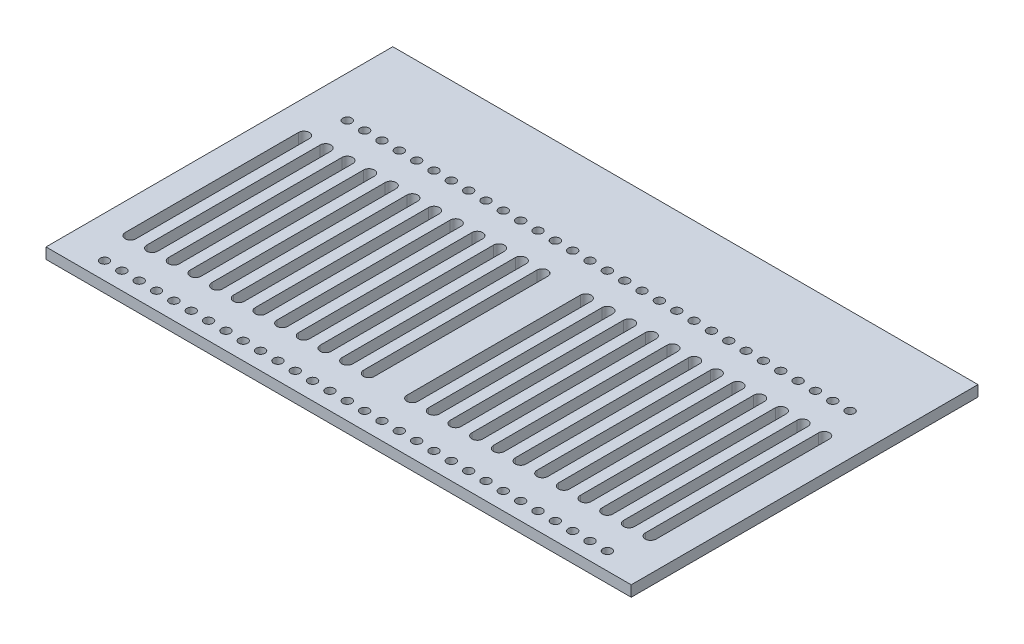
from build123d import *

# Parameters (mm, degrees)
SKETCH1_W           = 270
SKETCH1_H           = 160
BOSS_EXTRUDE1_DEPTH = 5
SKETCH2_R           = 2.025
CUT_EXTRUDE1_DEPTH  = 314.886922314
CUT_EXTRUDE2_DEPTH  = 314.886922314


with BuildPart() as part:
    # Sketch1 → Boss-Extrude1 (new body)
    with BuildSketch(Plane(origin=(0, 0, 0), x_dir=(1, 0, 0), z_dir=(0, 1, 0))):
        with Locations((135, -80)):
            Rectangle(SKETCH1_W, SKETCH1_H)
    extrude(amount=BOSS_EXTRUDE1_DEPTH)

    # Sketch2 → Cut-Extrude1 (cut, through all)
    with BuildSketch(Plane(origin=(0, 5, 0), x_dir=(1, 0, 0), z_dir=(0, 1, 0))):
        with Locations(Location((139, -152, 0), (0, 0, 270))):
            Circle(SKETCH2_R)
        with Locations(Location((147, -152, 0), (0, 0, 270))):
            Circle(SKETCH2_R)
        with Locations(Location((155, -152, 0), (0, 0, 270))):
            Circle(SKETCH2_R)
        with Locations(Location((163, -152, 0), (0, 0, 270))):
            Circle(SKETCH2_R)
        with Locations(Location((171, -152, 0), (0, 0, 270))):
            Circle(SKETCH2_R)
        with Locations(Location((179, -152, 0), (0, 0, 270))):
            Circle(SKETCH2_R)
        with Locations(Location((187, -152, 0), (0, 0, 270))):
            Circle(SKETCH2_R)
        with Locations(Location((195, -152, 0), (0, 0, 270))):
            Circle(SKETCH2_R)
        with Locations(Location((203, -152, 0), (0, 0, 270))):
            Circle(SKETCH2_R)
        with Locations(Location((211, -152, 0), (0, 0, 270))):
            Circle(SKETCH2_R)
        with Locations(Location((219, -152, 0), (0, 0, 270))):
            Circle(SKETCH2_R)
        with Locations(Location((227, -152, 0), (0, 0, 270))):
            Circle(SKETCH2_R)
        with Locations(Location((235, -152, 0), (0, 0, 270))):
            Circle(SKETCH2_R)
        with Locations(Location((243, -152, 0), (0, 0, 270))):
            Circle(SKETCH2_R)
        with Locations(Location((251, -152, 0), (0, 0, 270))):
            Circle(SKETCH2_R)
        with Locations(Location((19, -152, 0), (0, 0, 90))):
            Circle(SKETCH2_R)
        with Locations(Location((27, -152, 0), (0, 0, 90))):
            Circle(SKETCH2_R)
        with Locations(Location((35, -152, 0), (0, 0, 90))):
            Circle(SKETCH2_R)
        with Locations(Location((43, -152, 0), (0, 0, 90))):
            Circle(SKETCH2_R)
        with Locations(Location((51, -152, 0), (0, 0, 90))):
            Circle(SKETCH2_R)
        with Locations(Location((59, -152, 0), (0, 0, 90))):
            Circle(SKETCH2_R)
        with Locations(Location((67, -152, 0), (0, 0, 90))):
            Circle(SKETCH2_R)
        with Locations(Location((75, -152, 0), (0, 0, 90))):
            Circle(SKETCH2_R)
        with Locations(Location((83, -152, 0), (0, 0, 90))):
            Circle(SKETCH2_R)
        with Locations(Location((91, -152, 0), (0, 0, 90))):
            Circle(SKETCH2_R)
        with Locations(Location((99, -152, 0), (0, 0, 90))):
            Circle(SKETCH2_R)
        with Locations(Location((107, -152, 0), (0, 0, 90))):
            Circle(SKETCH2_R)
        with Locations(Location((115, -152, 0), (0, 0, 90))):
            Circle(SKETCH2_R)
        with Locations(Location((123, -152, 0), (0, 0, 90))):
            Circle(SKETCH2_R)
        with Locations(Location((131, -152, 0), (0, 0, 90))):
            Circle(SKETCH2_R)
        with Locations(Location((131, -40, 0), (0, 0, 270))):
            Circle(SKETCH2_R)
        with Locations(Location((123, -40, 0), (0, 0, 270))):
            Circle(SKETCH2_R)
        with Locations(Location((115, -40, 0), (0, 0, 270))):
            Circle(SKETCH2_R)
        with Locations(Location((107, -40, 0), (0, 0, 270))):
            Circle(SKETCH2_R)
        with Locations(Location((99, -40, 0), (0, 0, 270))):
            Circle(SKETCH2_R)
        with Locations(Location((91, -40, 0), (0, 0, 270))):
            Circle(SKETCH2_R)
        with Locations(Location((83, -40, 0), (0, 0, 270))):
            Circle(SKETCH2_R)
        with Locations(Location((75, -40, 0), (0, 0, 270))):
            Circle(SKETCH2_R)
        with Locations(Location((67, -40, 0), (0, 0, 270))):
            Circle(SKETCH2_R)
        with Locations(Location((59, -40, 0), (0, 0, 270))):
            Circle(SKETCH2_R)
        with Locations(Location((51, -40, 0), (0, 0, 270))):
            Circle(SKETCH2_R)
        with Locations(Location((43, -40, 0), (0, 0, 270))):
            Circle(SKETCH2_R)
        with Locations(Location((35, -40, 0), (0, 0, 270))):
            Circle(SKETCH2_R)
        with Locations(Location((27, -40, 0), (0, 0, 270))):
            Circle(SKETCH2_R)
        with Locations(Location((19, -40, 0), (0, 0, 270))):
            Circle(SKETCH2_R)
        with Locations(Location((251, -40, 0), (0, 0, 90))):
            Circle(SKETCH2_R)
        with Locations(Location((243, -40, 0), (0, 0, 90))):
            Circle(SKETCH2_R)
        with Locations(Location((235, -40, 0), (0, 0, 90))):
            Circle(SKETCH2_R)
        with Locations(Location((227, -40, 0), (0, 0, 90))):
            Circle(SKETCH2_R)
        with Locations(Location((219, -40, 0), (0, 0, 90))):
            Circle(SKETCH2_R)
        with Locations(Location((211, -40, 0), (0, 0, 90))):
            Circle(SKETCH2_R)
        with Locations(Location((203, -40, 0), (0, 0, 90))):
            Circle(SKETCH2_R)
        with Locations(Location((195, -40, 0), (0, 0, 90))):
            Circle(SKETCH2_R)
        with Locations(Location((187, -40, 0), (0, 0, 90))):
            Circle(SKETCH2_R)
        with Locations(Location((179, -40, 0), (0, 0, 90))):
            Circle(SKETCH2_R)
        with Locations(Location((171, -40, 0), (0, 0, 90))):
            Circle(SKETCH2_R)
        with Locations(Location((163, -40, 0), (0, 0, 90))):
            Circle(SKETCH2_R)
        with Locations(Location((155, -40, 0), (0, 0, 90))):
            Circle(SKETCH2_R)
        with Locations(Location((147, -40, 0), (0, 0, 90))):
            Circle(SKETCH2_R)
        with Locations(Location((139, -40, 0), (0, 0, 90))):
            Circle(SKETCH2_R)
    extrude(amount=-CUT_EXTRUDE1_DEPTH, mode=Mode.SUBTRACT)

    # Sketch3 → Cut-Extrude2 (cut, through all)
    with BuildSketch(Plane(origin=(0, 5, 0), x_dir=(1, 0, 0), z_dir=(0, 1, 0))):
        with BuildLine():
            Line((147.5, -56), (147.5, -136))
            ThreePointArc((147.5, -136), (145, -138.5), (142.5, -136))
            Line((142.5, -136), (142.5, -56))
            ThreePointArc((142.5, -56), (145, -53.5), (147.5, -56))
        make_face()
        with BuildLine():
            Line((157.5, -56), (157.5, -136))
            ThreePointArc((157.5, -136), (155, -138.5), (152.5, -136))
            Line((152.5, -136), (152.5, -56))
            ThreePointArc((152.5, -56), (155, -53.5), (157.5, -56))
        make_face()
        with BuildLine():
            Line((167.5, -56), (167.5, -136))
            ThreePointArc((167.5, -136), (165, -138.5), (162.5, -136))
            Line((162.5, -136), (162.5, -56))
            ThreePointArc((162.5, -56), (165, -53.5), (167.5, -56))
        make_face()
        with BuildLine():
            Line((177.5, -56), (177.5, -136))
            ThreePointArc((177.5, -136), (175, -138.5), (172.5, -136))
            Line((172.5, -136), (172.5, -56))
            ThreePointArc((172.5, -56), (175, -53.5), (177.5, -56))
        make_face()
        with BuildLine():
            Line((187.5, -56), (187.5, -136))
            ThreePointArc((187.5, -136), (185, -138.5), (182.5, -136))
            Line((182.5, -136), (182.5, -56))
            ThreePointArc((182.5, -56), (185, -53.5), (187.5, -56))
        make_face()
        with BuildLine():
            Line((197.5, -56), (197.5, -136))
            ThreePointArc((197.5, -136), (195, -138.5), (192.5, -136))
            Line((192.5, -136), (192.5, -56))
            ThreePointArc((192.5, -56), (195, -53.5), (197.5, -56))
        make_face()
        with BuildLine():
            Line((207.5, -56), (207.5, -136))
            ThreePointArc((207.5, -136), (205, -138.5), (202.5, -136))
            Line((202.5, -136), (202.5, -56))
            ThreePointArc((202.5, -56), (205, -53.5), (207.5, -56))
        make_face()
        with BuildLine():
            Line((217.5, -56), (217.5, -136))
            ThreePointArc((217.5, -136), (215, -138.5), (212.5, -136))
            Line((212.5, -136), (212.5, -56))
            ThreePointArc((212.5, -56), (215, -53.5), (217.5, -56))
        make_face()
        with BuildLine():
            Line((227.5, -56), (227.5, -136))
            ThreePointArc((227.5, -136), (225, -138.5), (222.5, -136))
            Line((222.5, -136), (222.5, -56))
            ThreePointArc((222.5, -56), (225, -53.5), (227.5, -56))
        make_face()
        with BuildLine():
            Line((237.5, -56), (237.5, -136))
            ThreePointArc((237.5, -136), (235, -138.5), (232.5, -136))
            Line((232.5, -136), (232.5, -56))
            ThreePointArc((232.5, -56), (235, -53.5), (237.5, -56))
        make_face()
        with BuildLine():
            Line((247.5, -56), (247.5, -136))
            ThreePointArc((247.5, -136), (245, -138.5), (242.5, -136))
            Line((242.5, -136), (242.5, -56))
            ThreePointArc((242.5, -56), (245, -53.5), (247.5, -56))
        make_face()
        with BuildLine():
            Line((257.5, -56), (257.5, -136))
            ThreePointArc((257.5, -136), (255, -138.5), (252.5, -136))
            Line((252.5, -136), (252.5, -56))
            ThreePointArc((252.5, -56), (255, -53.5), (257.5, -56))
        make_face()
        with BuildLine():
            Line((122.5, -56), (122.5, -136))
            ThreePointArc((122.5, -136), (125, -138.5), (127.5, -136))
            Line((127.5, -136), (127.5, -56))
            ThreePointArc((127.5, -56), (125, -53.5), (122.5, -56))
        make_face()
        with BuildLine():
            Line((112.5, -56), (112.5, -136))
            ThreePointArc((112.5, -136), (115, -138.5), (117.5, -136))
            Line((117.5, -136), (117.5, -56))
            ThreePointArc((117.5, -56), (115, -53.5), (112.5, -56))
        make_face()
        with BuildLine():
            Line((102.5, -56), (102.5, -136))
            ThreePointArc((102.5, -136), (105, -138.5), (107.5, -136))
            Line((107.5, -136), (107.5, -56))
            ThreePointArc((107.5, -56), (105, -53.5), (102.5, -56))
        make_face()
        with BuildLine():
            Line((92.5, -56), (92.5, -136))
            ThreePointArc((92.5, -136), (95, -138.5), (97.5, -136))
            Line((97.5, -136), (97.5, -56))
            ThreePointArc((97.5, -56), (95, -53.5), (92.5, -56))
        make_face()
        with BuildLine():
            Line((82.5, -56), (82.5, -136))
            ThreePointArc((82.5, -136), (85, -138.5), (87.5, -136))
            Line((87.5, -136), (87.5, -56))
            ThreePointArc((87.5, -56), (85, -53.5), (82.5, -56))
        make_face()
        with BuildLine():
            Line((72.5, -56), (72.5, -136))
            ThreePointArc((72.5, -136), (75, -138.5), (77.5, -136))
            Line((77.5, -136), (77.5, -56))
            ThreePointArc((77.5, -56), (75, -53.5), (72.5, -56))
        make_face()
        with BuildLine():
            Line((62.5, -56), (62.5, -136))
            ThreePointArc((62.5, -136), (65, -138.5), (67.5, -136))
            Line((67.5, -136), (67.5, -56))
            ThreePointArc((67.5, -56), (65, -53.5), (62.5, -56))
        make_face()
        with BuildLine():
            Line((52.5, -56), (52.5, -136))
            ThreePointArc((52.5, -136), (55, -138.5), (57.5, -136))
            Line((57.5, -136), (57.5, -56))
            ThreePointArc((57.5, -56), (55, -53.5), (52.5, -56))
        make_face()
        with BuildLine():
            Line((42.5, -56), (42.5, -136))
            ThreePointArc((42.5, -136), (45, -138.5), (47.5, -136))
            Line((47.5, -136), (47.5, -56))
            ThreePointArc((47.5, -56), (45, -53.5), (42.5, -56))
        make_face()
        with BuildLine():
            Line((32.5, -56), (32.5, -136))
            ThreePointArc((32.5, -136), (35, -138.5), (37.5, -136))
            Line((37.5, -136), (37.5, -56))
            ThreePointArc((37.5, -56), (35, -53.5), (32.5, -56))
        make_face()
        with BuildLine():
            Line((22.5, -56), (22.5, -136))
            ThreePointArc((22.5, -136), (25, -138.5), (27.5, -136))
            Line((27.5, -136), (27.5, -56))
            ThreePointArc((27.5, -56), (25, -53.5), (22.5, -56))
        make_face()
        with BuildLine():
            Line((12.5, -56), (12.5, -136))
            ThreePointArc((12.5, -136), (15, -138.5), (17.5, -136))
            Line((17.5, -136), (17.5, -56))
            ThreePointArc((17.5, -56), (15, -53.5), (12.5, -56))
        make_face()
    extrude(amount=-CUT_EXTRUDE2_DEPTH, mode=Mode.SUBTRACT)


solid = part.part
